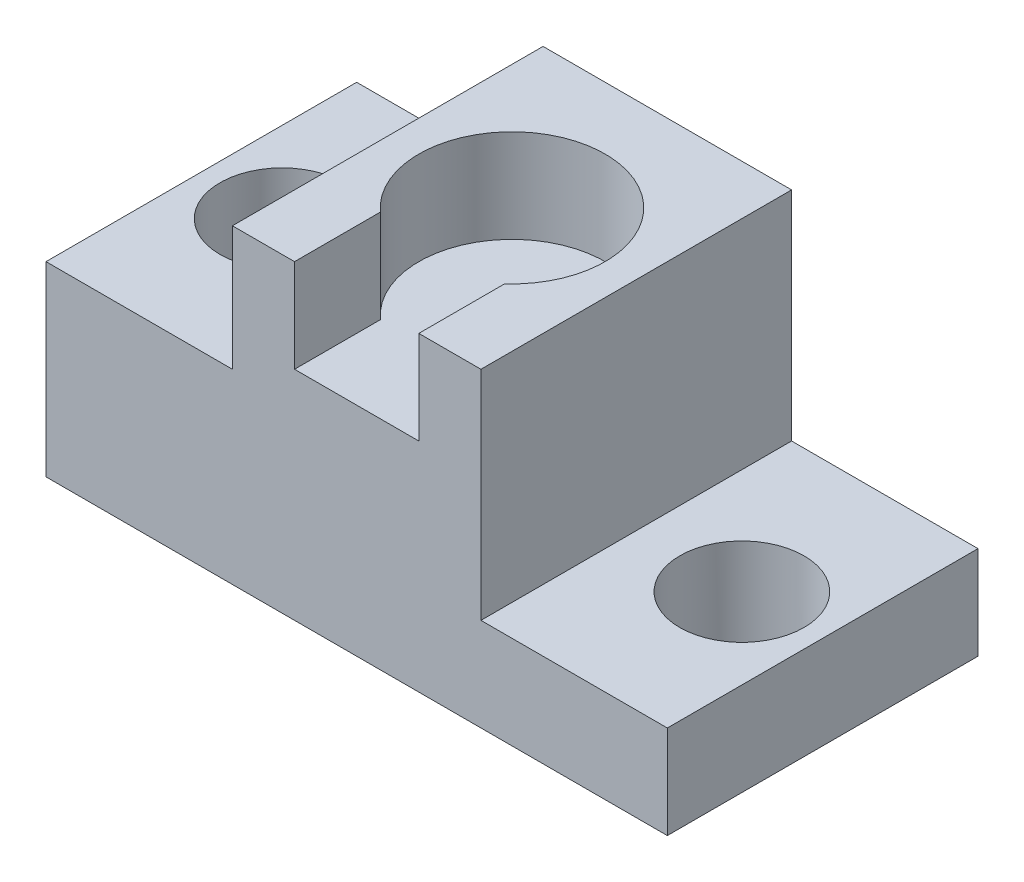
from build123d import *

# Parameters (mm, degrees)
RESSALTO_EXTRUS_O1_DEPTH = 50
ESBO_O2_R                = 10
ESBO_O2_R_2              = 10.000432036
CORTE_EXTRUS_O1_DEPTH    = 87.602540378
ESBO_O3_R                = 15
CORTE_EXTRUS_O2_DEPTH    = 15
CORTE_EXTRUS_O3_DEPTH    = 15


with BuildPart() as part:
    # Esboço1 → Ressalto-extrusão1 (new body)
    with BuildSketch(Plane.XY):
        Polygon((-50, 0), (50, 0), (50, 15), (20, 15), (20, 50), (-20, 50), (-20, 30), (-50, 30), align=None)
    extrude(amount=RESSALTO_EXTRUS_O1_DEPTH)

    # Esboço2 → Corte-extrusão1 (cut, through all)
    with BuildSketch(Plane(origin=(0, 50, 0), x_dir=(1, 0, 0), z_dir=(0, 1, 0))):
        with Locations(Location((-37, -25, 0), (0, 0, 270))):
            Circle(ESBO_O2_R)
        with Locations(Location((37, -25, 0), (0, 0, 270))):
            Circle(ESBO_O2_R_2)
    extrude(amount=-CORTE_EXTRUS_O1_DEPTH, mode=Mode.SUBTRACT)

    # Esboço3 → Corte-extrusão2 (cut)
    with BuildSketch(Plane(origin=(0, 50, 0), x_dir=(1, 0, 0), z_dir=(0, 1, 0))):
        with Locations(Location((0, -25, 0), (0, 0, 270))):
            Circle(ESBO_O3_R)
    extrude(amount=-CORTE_EXTRUS_O2_DEPTH, mode=Mode.SUBTRACT)

    # Esboço5 → Corte-extrusão3 (cut)
    with BuildSketch(Plane(origin=(0, 50, 0), x_dir=(1, 0, 0), z_dir=(0, 1, 0))):
        with BuildLine():
            Line((-10, -36.180339887), (-10, -50))
            Line((-10, -50), (10, -50))
            Line((10, -50), (10, -36.180339887))
            ThreePointArc((10, -36.180339887), (0, -40), (-10, -36.180339887))
        make_face()
    extrude(amount=-CORTE_EXTRUS_O3_DEPTH, mode=Mode.SUBTRACT)


solid = part.part
